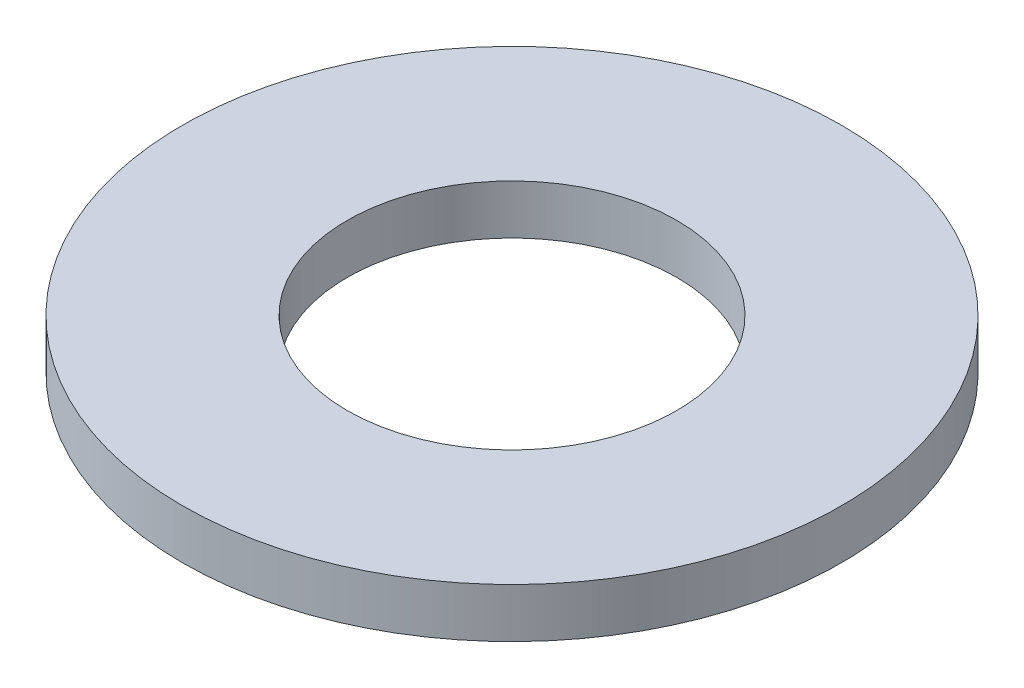
from build123d import *

# Parameters (mm, degrees)
SKETCH1_R           = 2
SKETCH1_R_2         = 1
BOSS_EXTRUDE1_DEPTH = 0.3


with BuildPart() as part:
    # Sketch1 → Boss-Extrude1 (new body)
    with BuildSketch(Plane(origin=(0, 0, 0), x_dir=(1, 0, 0), z_dir=(0, 1, 0))):
        with Locations(Location((0, 0, 0), (0, 0, 270))):
            Circle(SKETCH1_R)
        with Locations(Location((0, 0, 0), (0, 0, 270))):
            Circle(SKETCH1_R_2, mode=Mode.SUBTRACT)
    extrude(amount=BOSS_EXTRUDE1_DEPTH)


solid = part.part
